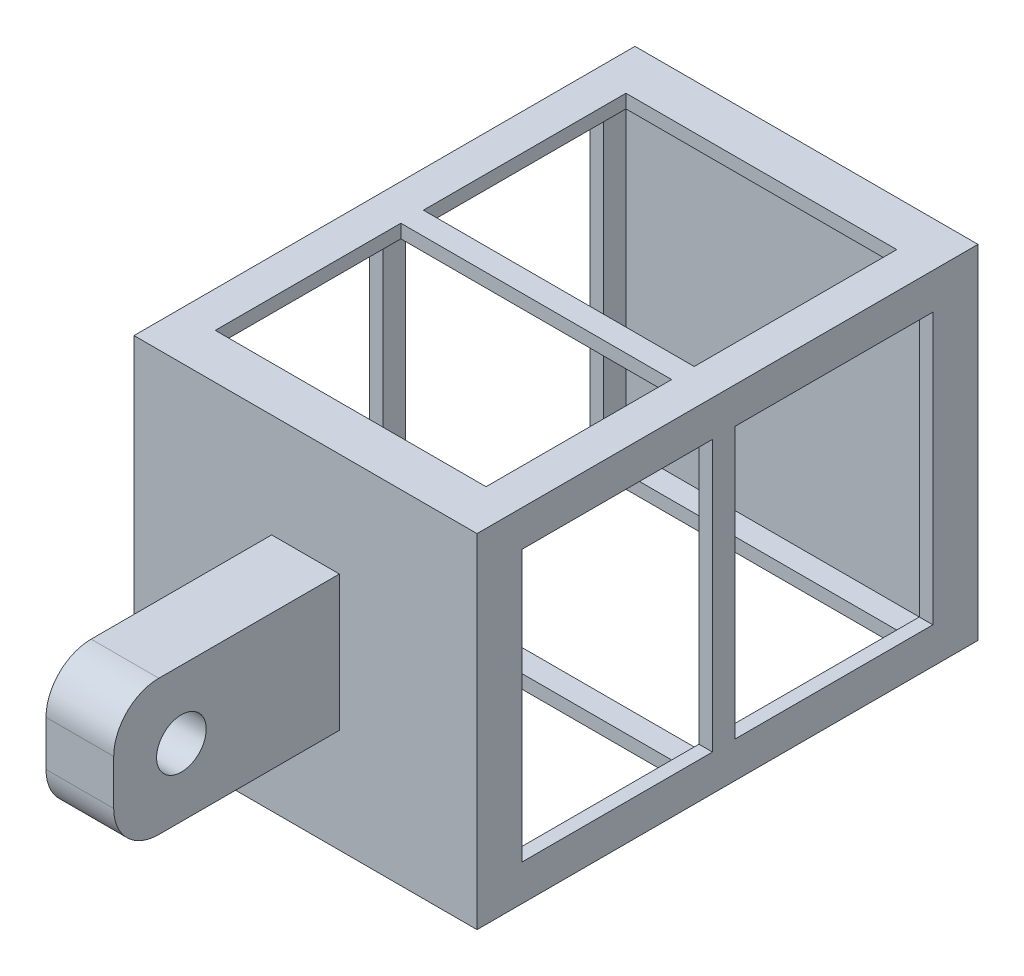
from build123d import *

# Parameters (mm, degrees)
ESQUISSE1_W             = 76
ESQUISSE1_H             = 76
ESQUISSE1_W_2           = 70
ESQUISSE1_H_2           = 70
BOSS_EXTRU_2_DEPTH      = 101
ESQUISSE2_W             = 76
ESQUISSE2_H             = 76
BOSS_EXTRU_3_DEPTH      = 5
ESQUISSE3_W             = 76
ESQUISSE3_H             = 76
BOSS_EXTRU_4_DEPTH      = 5
ESQUISSE4_W             = 60
ESQUISSE4_H             = 44.878799425
ESQUISSE4_H_2           = 41.121200575
ENL_V_MAT_EXTRU_1_DEPTH = 80
ESQUISSE5_W             = 43.832159463
ESQUISSE5_H             = 60
ESQUISSE5_W_2           = 42.167840537
ENL_V_MAT_EXTRU_2_DEPTH = 80
ESQUISSE8_W             = 15
ESQUISSE8_H             = 30
BOSS_EXTRU_6_DEPTH      = 50
CONG_6_R                = 10
CONG_7_R                = 10
ESQUISSE10_R            = 5.5
ENL_V_MAT_EXTRU_3_DEPTH = 25
ESQUISSE11_R            = 7.5
ENL_V_MAT_EXTRU_4_DEPTH = 1


with BuildPart() as part:
    # Esquisse1 → Boss.-Extru.2 (new body)
    with BuildSketch(Plane.XY):
        with Locations((1.043095631, -5.469290785)):
            Rectangle(ESQUISSE1_W, ESQUISSE1_H)
        with Locations((1.043095631, -5.469290785)):
            Rectangle(ESQUISSE1_W_2, ESQUISSE1_H_2, mode=Mode.SUBTRACT)
    extrude(amount=BOSS_EXTRU_2_DEPTH)

    # Esquisse2 → Boss.-Extru.3 (add)
    with BuildSketch(Plane.XY.offset(101)):
        with Locations((1.043095631, -5.469290785)):
            Rectangle(ESQUISSE2_W, ESQUISSE2_H)
    extrude(amount=BOSS_EXTRU_3_DEPTH)

    # Esquisse3 → Boss.-Extru.4 (add)
    with BuildSketch(Plane(origin=(0, 0, 0), x_dir=(-1, 0, 0), z_dir=(0, 0, -1))):
        with Locations((-1.043095631, -5.469290785)):
            Rectangle(ESQUISSE3_W, ESQUISSE3_H)
    extrude(amount=BOSS_EXTRU_4_DEPTH)

    # Esquisse4 → Enlèv. mat.-Extru.1 (cut)
    with BuildSketch(Plane(origin=(0, 32.530709215, 0), x_dir=(1, 0, 0), z_dir=(0, 1, 0))):
        with Locations((1.043095631, -27.439399713)):
            Rectangle(ESQUISSE4_W, ESQUISSE4_H)
        with Locations((1.043095631, -75.439399713)):
            Rectangle(ESQUISSE4_W, ESQUISSE4_H_2)
    extrude(amount=-ENL_V_MAT_EXTRU_1_DEPTH, mode=Mode.SUBTRACT)

    # Esquisse5 → Enlèv. mat.-Extru.2 (cut)
    with BuildSketch(Plane.ZY.offset(36.956904369)):
        with Locations((26.916079732, -5.469290785)):
            Rectangle(ESQUISSE5_W, ESQUISSE5_H)
        with Locations((74.916079732, -5.469290785)):
            Rectangle(ESQUISSE5_W_2, ESQUISSE5_H)
    extrude(amount=-ENL_V_MAT_EXTRU_2_DEPTH, mode=Mode.SUBTRACT)

    # Esquisse8 → Boss.-Extru.6 (add)
    with BuildSketch(Plane.XY.offset(106)):
        with Locations((1.043095631, -5.469290785)):
            Rectangle(ESQUISSE8_W, ESQUISSE8_H)
    extrude(amount=BOSS_EXTRU_6_DEPTH)

    # Congé6
    cong_6_edges = [part.edges().sort_by_distance(p)[0] for p in [
        (1.043095631, -20.469290785, 156),
    ]]
    fillet(cong_6_edges, radius=CONG_6_R)

    # Congé7
    cong_7_edges = [part.edges().sort_by_distance(p)[0] for p in [
        (1.043095631, 9.530709215, 156),
    ]]
    fillet(cong_7_edges, radius=CONG_7_R)

    # Esquisse10 → Enlèv. mat.-Extru.3 (cut)
    with BuildSketch(Plane.ZY.offset(6.456904369)):
        with Locations(Location((141, -5.469290785, 0), (0, 0, 270))):
            Circle(ESQUISSE10_R)
    extrude(amount=-ENL_V_MAT_EXTRU_3_DEPTH, mode=Mode.SUBTRACT)

    # Esquisse11 → Enlèv. mat.-Extru.4 (cut)
    with BuildSketch(Plane.ZY.offset(6.456904369)):
        with Locations(Location((141, -5.469290785, 0), (0, 0, 270))):
            Circle(ESQUISSE11_R)
    extrude(amount=-ENL_V_MAT_EXTRU_4_DEPTH, mode=Mode.SUBTRACT)


solid = part.part
